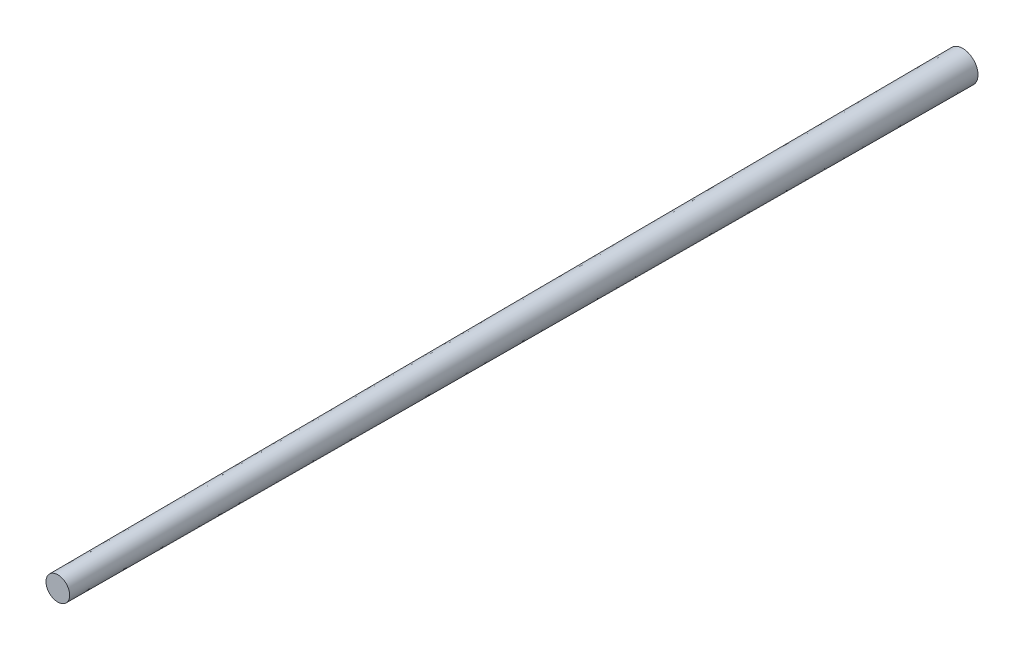
from build123d import *

# Parameters (mm, degrees)
SKETCH1_R      = 22
NECKPOLE_DEPTH = 1300
NECKPOLE_TAPER = 0.22


with BuildPart() as part:
    # Sketch1 → NeckPole (new body)
    with BuildSketch(Plane.XY):
        Circle(SKETCH1_R)
    extrude(amount=NECKPOLE_DEPTH, taper=NECKPOLE_TAPER)


solid = part.part
